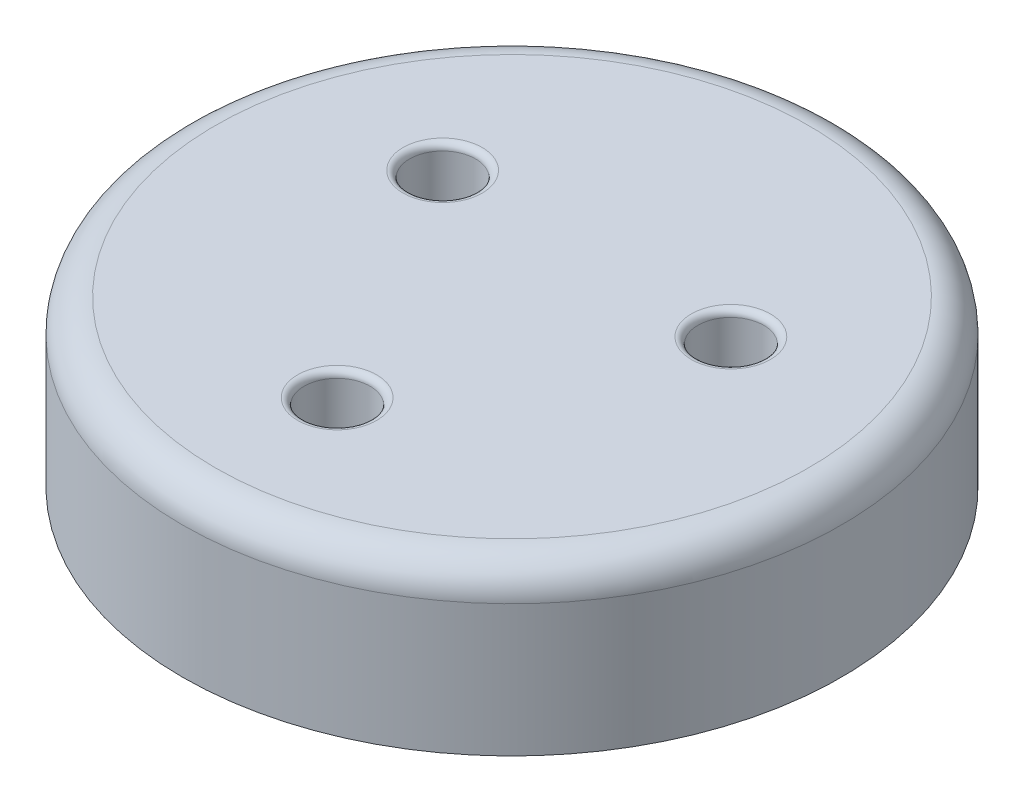
from build123d import *

# Parameters (mm, degrees)
SKETCH1_R           = 10
SKETCH1_R_2         = 1
BOSS_EXTRUDE1_DEPTH = 5
FILLET1_R           = 1
FILLET2_R           = 0.2


with BuildPart() as part:
    # Sketch1 → Boss-Extrude1 (new body)
    with BuildSketch(Plane(origin=(0, 0, 0), x_dir=(1, 0, 0), z_dir=(0, 1, 0))):
        with Locations(Location((0, 0, 0), (0, 0, 270))):
            Circle(SKETCH1_R)
        with Locations(Location((-4.372934276, 2.268231964, 0), (0, 0, 270))):
            Circle(SKETCH1_R_2, mode=Mode.SUBTRACT)
        with Locations(Location((4.372934276, 2.268231964, 0), (0, 0, 270))):
            Circle(SKETCH1_R_2, mode=Mode.SUBTRACT)
        with Locations(Location((0, -5.30591238, 0), (0, 0, 270))):
            Circle(SKETCH1_R_2, mode=Mode.SUBTRACT)
    extrude(amount=BOSS_EXTRUDE1_DEPTH)

    # Fillet1
    fillet1_edges = [part.edges().sort_by_distance(p)[0] for p in [
        (0, 5, -10),
    ]]
    fillet(fillet1_edges, radius=FILLET1_R)

    # Fillet2
    fillet2_edges = [part.edges().sort_by_distance(p)[0] for p in [
        (0, 5, 4.30591238),
        (4.372934276, 5, -3.268231964),
        (-4.372934276, 5, -3.268231964),
    ]]
    fillet(fillet2_edges, radius=FILLET2_R)


solid = part.part
